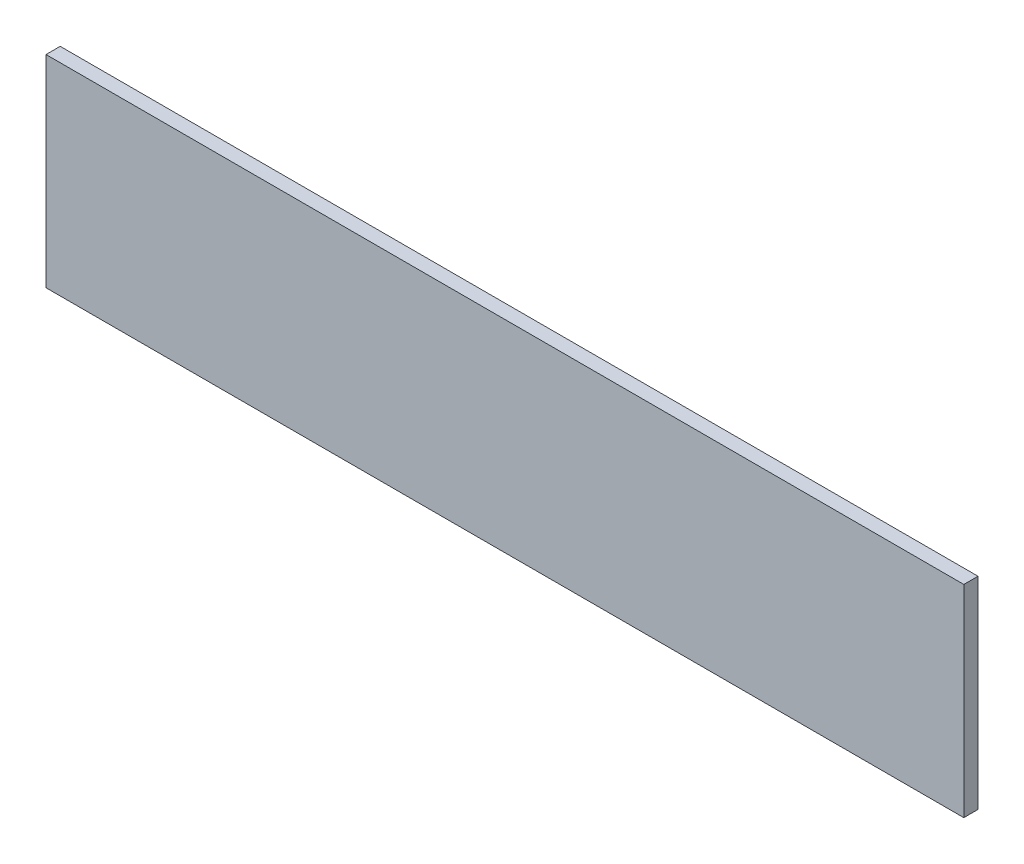
from build123d import *

# Parameters (mm, degrees)
SKETCH1_W           = 388
SKETCH1_H           = 85.4
BOSS_EXTRUDE1_DEPTH = 6


with BuildPart() as part:
    # Sketch1 → Boss-Extrude1 (new body)
    with BuildSketch(Plane.XY):
        with Locations((194, 42.7)):
            Rectangle(SKETCH1_W, SKETCH1_H)
    extrude(amount=BOSS_EXTRUDE1_DEPTH)


solid = part.part
